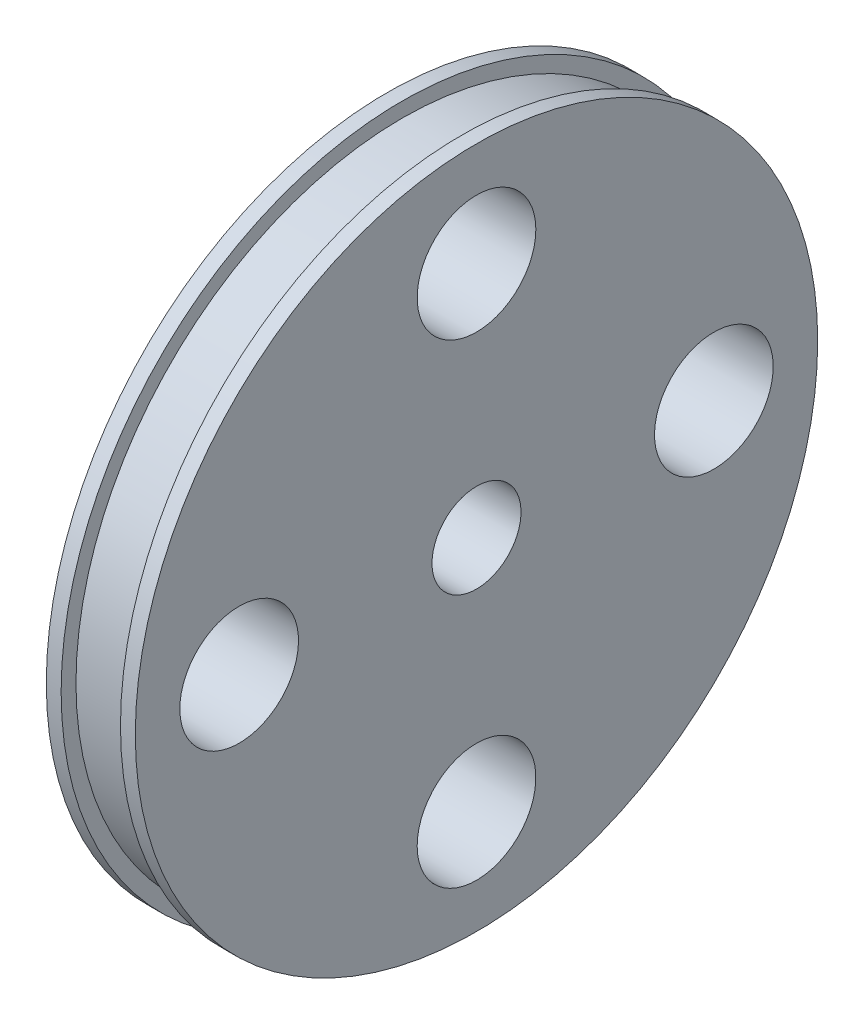
from build123d import *

# Parameters (mm, degrees)
SKETCH2_R          = 20
CUT_EXTRUDE1_DEPTH = 177.139149538
CIRPATTERN1_COUNT  = 4


with BuildPart() as part:
    # Sketch1 → Revolve1 (revolve)
    with BuildSketch(Plane.XY, mode=Mode.PRIVATE) as revolve1_sk:
        Polygon((0, 0), (0, 100), (5, 100), (5, 95), (25, 95), (25, 100), (30, 100), (30, 0), align=None)
    revolve(revolve1_sk.sketch.rotate(Axis((-34.60978596, -15, 0), (1, 0, 0)), 90), axis=Axis((-34.60978596, -15, 0), (1, 0, 0)))

    # Sketch2 → Cut-Extrude1 (cut, through all)
    with BuildSketch(Plane(origin=(30, 0, 0), x_dir=(0, 0, -1), z_dir=(1, 0, 0))):
        with Locations((0, 65)):
            Circle(SKETCH2_R)
    cut_extrude1 = extrude(amount=-CUT_EXTRUDE1_DEPTH, mode=Mode.SUBTRACT)

    # CirPattern1: Cut-Extrude1 ×4 about axis
    cirpattern1_axis = Axis((0, -15, 0), (1, 0, 0))
    for i in range(1, CIRPATTERN1_COUNT):
        add(cut_extrude1.rotate(cirpattern1_axis, i * 360 / CIRPATTERN1_COUNT), mode=Mode.SUBTRACT)


solid = part.part
